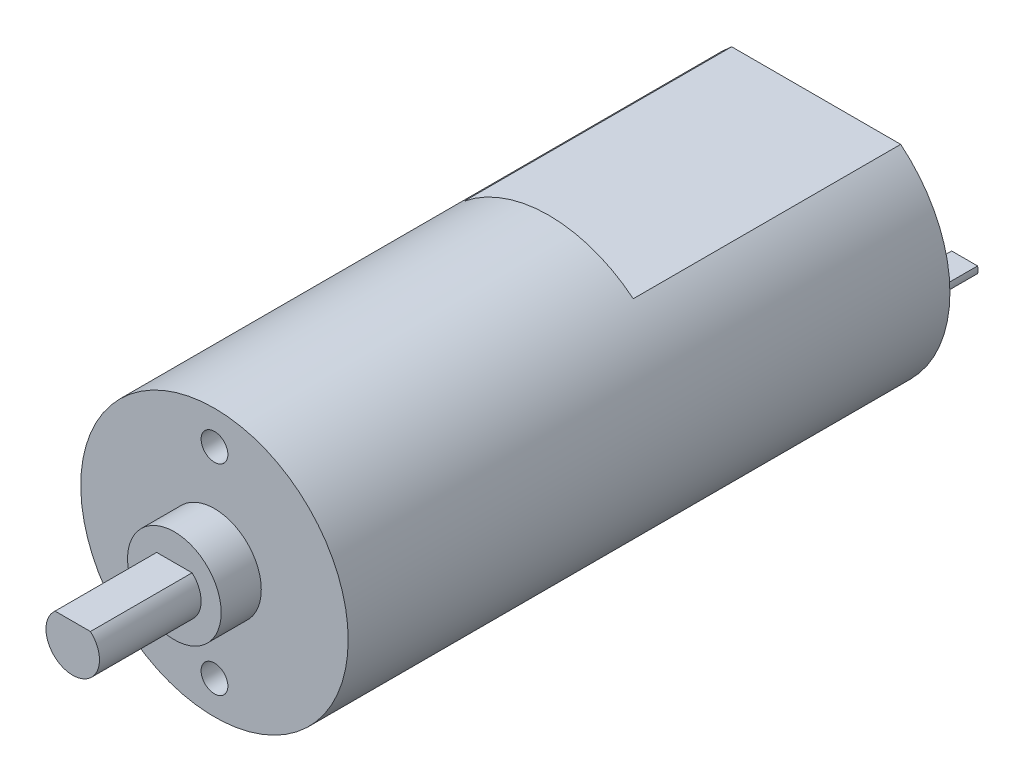
from build123d import *

# Parameters (mm, degrees)
EXTRUDE_1_DEPTH     = 20
SKETCH_2_R          = 10
EXTRUDE_2_DEPTH     = 25
SKETCH_3_R          = 1
CUT_EXTRUDE_1_DEPTH = 4
SKETCH_4_R          = 3
EXTRUDE_3_DEPTH     = 2
SKETCH_5_R          = 1
EXTRUDE_4_DEPTH     = 0.5
EXTRUDE_6_DEPTH     = 3
SKETCH_7_R          = 3.5
EXTRUDE_7_DEPTH     = 3
EXTRUDE_8_DEPTH     = 7.6


with BuildPart() as part:
    # 草图1 → 凸台-拉伸1 (new body)
    with BuildSketch(Plane.XY):
        with BuildLine():
            Line((-6.31961233, 7.75), (6.31961233, 7.75))
            ThreePointArc((6.31961233, 7.75), (10, 0), (6.31961233, -7.75))
            Line((6.31961233, -7.75), (-6.31961233, -7.75))
            ThreePointArc((-6.31961233, -7.75), (-10, 0), (-6.31961233, 7.75))
        make_face()
    extrude(amount=EXTRUDE_1_DEPTH)

    # 草图2 → 凸台-拉伸2 (add)
    with BuildSketch(Plane.XY.offset(20)):
        with Locations(Location((0, 0, 0), (0, 0, 129.194967426))):
            Circle(SKETCH_2_R)
    extrude(amount=EXTRUDE_2_DEPTH)

    # 草图3 → 切除-拉伸1 (cut)
    with BuildSketch(Plane.XY.offset(45)):
        with Locations((0, 7.5)):
            Circle(SKETCH_3_R)
        with Locations((0, -7.5)):
            Circle(SKETCH_3_R)
    extrude(amount=-CUT_EXTRUDE_1_DEPTH, mode=Mode.SUBTRACT)

    # 草图4 → 凸台-拉伸3 (add)
    with BuildSketch(Plane(origin=(0, 0, 0), x_dir=(-1, 0, 0), z_dir=(0, 0, -1))):
        Circle(SKETCH_4_R)
    extrude(amount=EXTRUDE_3_DEPTH)

    # 草图5 → 凸台-拉伸4 (add)
    with BuildSketch(Plane(origin=(0, 0, 0), x_dir=(-1, 0, 0), z_dir=(0, 0, -1))):
        with Locations(Location((-7.6, -1, 0), (0, 0, 180))):
            Circle(SKETCH_5_R)
        with Locations(Location((7.6, 1, 0), (0, 0, 180))):
            Circle(SKETCH_5_R)
    extrude(amount=EXTRUDE_4_DEPTH)

    # 草图6 → 凸台-拉伸6 (add)
    with BuildSketch(Plane(origin=(0, 0, -0.5), x_dir=(-1, 0, 0), z_dir=(0, 0, -1))):
        with BuildLine():
            Line((-8.568245837, -1.25), (-6.631754163, -1.25))
            ThreePointArc((-6.631754163, -1.25), (-6.6, -1), (-6.631754163, -0.75))
            Line((-6.631754163, -0.75), (-8.568245837, -0.75))
            ThreePointArc((-8.568245837, -0.75), (-8.6, -1), (-8.568245837, -1.25))
        make_face()
        with BuildLine():
            Line((6.631754163, 0.75), (8.568245837, 0.75))
            ThreePointArc((8.568245837, 0.75), (8.6, 1), (8.568245837, 1.25))
            Line((8.568245837, 1.25), (6.631754163, 1.25))
            ThreePointArc((6.631754163, 1.25), (6.6, 1), (6.631754163, 0.75))
        make_face()
    extrude(amount=EXTRUDE_6_DEPTH)

    # 草图7 → 凸台-拉伸7 (add)
    with BuildSketch(Plane.XY.offset(45)):
        Circle(SKETCH_7_R)
    extrude(amount=EXTRUDE_7_DEPTH)

    # 草图9 → 凸台-拉伸8 (add)
    with BuildSketch(Plane.XY.offset(48)):
        with BuildLine():
            Line((-1.322875656, 1.5), (1.322875656, 1.5))
            ThreePointArc((1.322875656, 1.5), (0, -2), (-1.322875656, 1.5))
        make_face()
    extrude(amount=EXTRUDE_8_DEPTH)


solid = part.part
